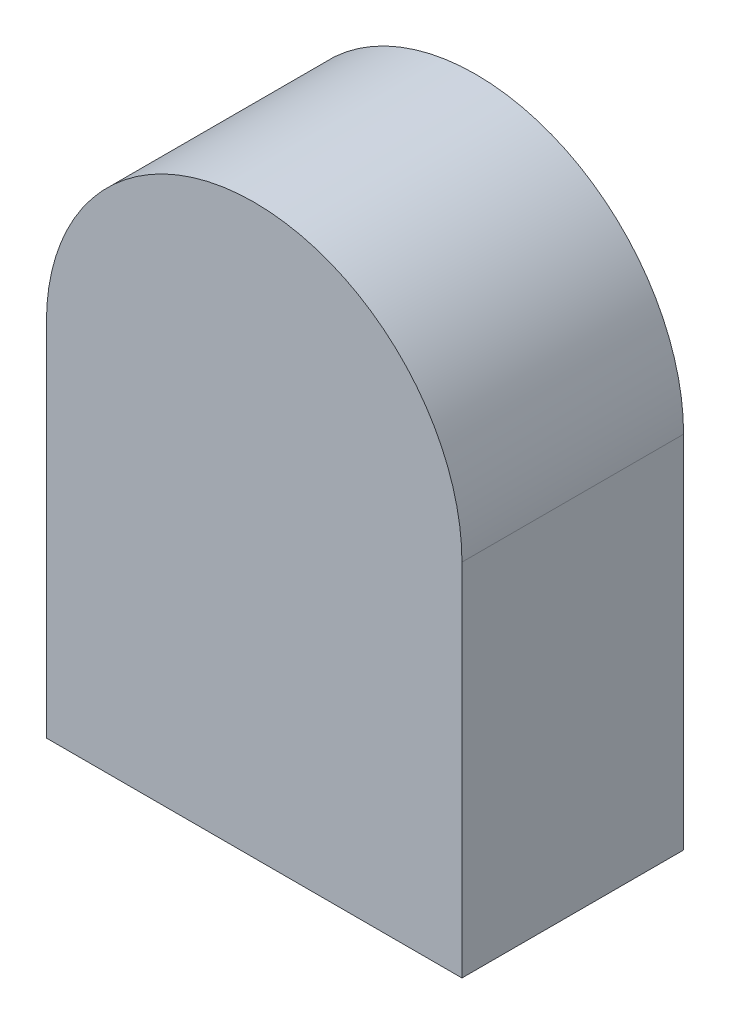
from build123d import *

# Parameters (mm, degrees)
EXTRUDE_THIN1_DEPTH = 16
CUT_EXTRUDE1_DEPTH  = 10
BOSS_EXTRUDE1_START = -1.5
BOSS_EXTRUDE1_DEPTH = 1.5


with BuildPart() as part:
    # Sketch1 → Extrude-Thin1 (new body)
    with BuildSketch(Plane.XY):
        with BuildLine():
            Line((-15, 26), (-15, 0))
            Line((-15, 0), (15, 0))
            Line((15, 0), (15, 26))
            ThreePointArc((15, 26), (0, 41), (-15, 26))
        make_face()
        with BuildLine():
            Line((-14, 26), (-14, 1))
            Line((-14, 1), (14, 1))
            Line((14, 1), (14, 26))
            ThreePointArc((14, 26), (0, 40), (-14, 26))
        make_face(mode=Mode.SUBTRACT)
    extrude(amount=EXTRUDE_THIN1_DEPTH)

    # Sketch2 → Cut-Extrude1 (cut)
    with BuildSketch(Plane(origin=(0, 0, 0), x_dir=(-1, 0, 0), z_dir=(0, -1, 0))):
        with BuildLine():
            Line((3, -7), (3, 0))
            Line((3, 0), (-3, 0))
            Line((-3, 0), (-3, -7))
            ThreePointArc((-3, -7), (0, -10), (3, -7))
        make_face()
    extrude(amount=-CUT_EXTRUDE1_DEPTH, mode=Mode.SUBTRACT)

    # Sketch3 → Boss-Extrude1 (add)
    with BuildSketch(Plane.XY.offset(16).offset(BOSS_EXTRUDE1_START)):
        with BuildLine():
            Line((-15, 0), (15, 0))
            Line((15, 0), (15, 26))
            ThreePointArc((15, 26), (0, 41), (-15, 26))
            Line((-15, 26), (-15, 0))
        make_face()
    extrude(amount=BOSS_EXTRUDE1_DEPTH)


solid = part.part
